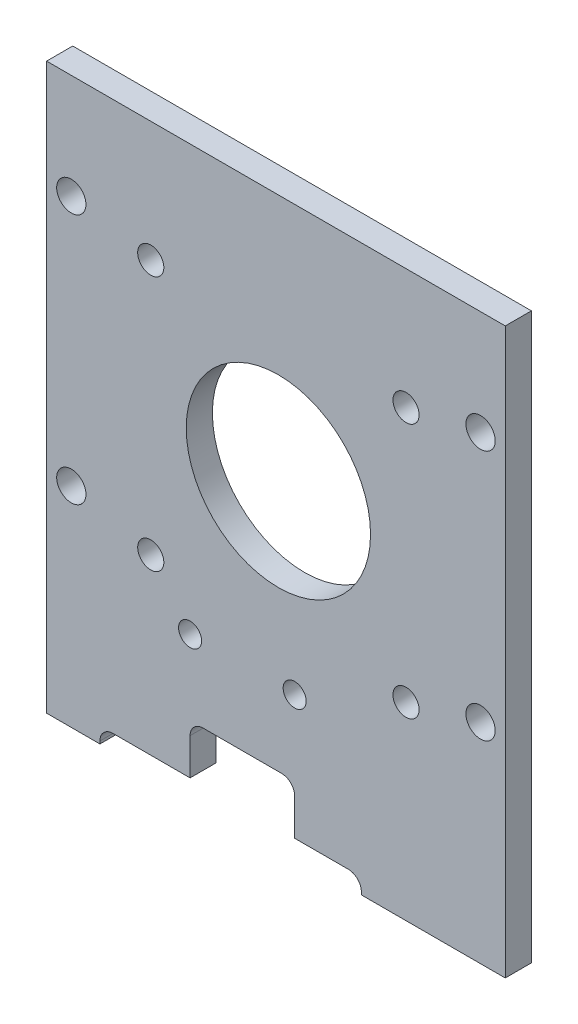
from build123d import *

# Parameters (mm, degrees)
SKETCH1_W           = 55.700676
SKETCH1_H           = 68.58
BOSS_EXTRUDE1_DEPTH = 3.175
SKETCH2_R           = 11.190499971
SKETCH2_R_2         = 1.5875
SKETCH2_R_3         = 1.397
SKETCH2_W           = 12.7
SKETCH2_H           = 7.9375
CUT_EXTRUDE1_DEPTH  = 89.407365824
SKETCH3_W           = 31.75
SKETCH3_H           = 1.905
CUT_EXTRUDE2_DEPTH  = 89.407365824
SKETCH4_R           = 1.778
CUT_EXTRUDE3_DEPTH  = 89.407365824
FILLET1_R           = 1.5875


with BuildPart() as part:
    # Sketch1 → Boss-Extrude1 (new body)
    with BuildSketch(Plane.XY):
        with Locations((27.850338, 34.29)):
            Rectangle(SKETCH1_W, SKETCH1_H)
    extrude(amount=BOSS_EXTRUDE1_DEPTH)

    # Sketch2 → Cut-Extrude1 (cut, through all)
    with BuildSketch(Plane.XY.offset(3.175)):
        with Locations((28.1492, 38.475)):
            Circle(SKETCH2_R)
        with Locations((12.6492, 53.975)):
            Circle(SKETCH2_R_2)
        with Locations((43.6492, 53.975)):
            Circle(SKETCH2_R_2)
        with Locations((43.6492, 22.975)):
            Circle(SKETCH2_R_2)
        with Locations((12.6492, 22.975)):
            Circle(SKETCH2_R_2)
        with Locations((17.4242, 17.005299976)):
            Circle(SKETCH2_R_3)
        with Locations((30.1242, 17.005299976)):
            Circle(SKETCH2_R_3)
        with Locations((23.7742, 3.96875)):
            Rectangle(SKETCH2_W, SKETCH2_H)
    extrude(amount=-CUT_EXTRUDE1_DEPTH, mode=Mode.SUBTRACT)

    # Sketch3 → Cut-Extrude2 (cut, through all)
    with BuildSketch(Plane.XY.offset(3.175)):
        with Locations((22.352, 0.9525)):
            Rectangle(SKETCH3_W, SKETCH3_H)
    extrude(amount=-CUT_EXTRUDE2_DEPTH, mode=Mode.SUBTRACT)

    # Sketch4 → Cut-Extrude3 (cut, through all)
    with BuildSketch(Plane.XY.offset(3.175)):
        with Locations((3, 55.88)):
            Circle(SKETCH4_R)
        with Locations((3, 25.4)):
            Circle(SKETCH4_R)
        with Locations((52.700676, 25.4)):
            Circle(SKETCH4_R)
        with Locations((52.700676, 55.88)):
            Circle(SKETCH4_R)
    extrude(amount=-CUT_EXTRUDE3_DEPTH, mode=Mode.SUBTRACT)

    # Fillet1
    fillet1_edges = [part.edges().sort_by_distance(p)[0] for p in [
        (17.4242, 7.9375, 1.5875),
        (30.1242, 7.9375, 1.5875),
        (6.477, 1.905, 1.5875),
        (38.227, 1.905, 1.5875),
    ]]
    fillet(fillet1_edges, radius=FILLET1_R)


solid = part.part
